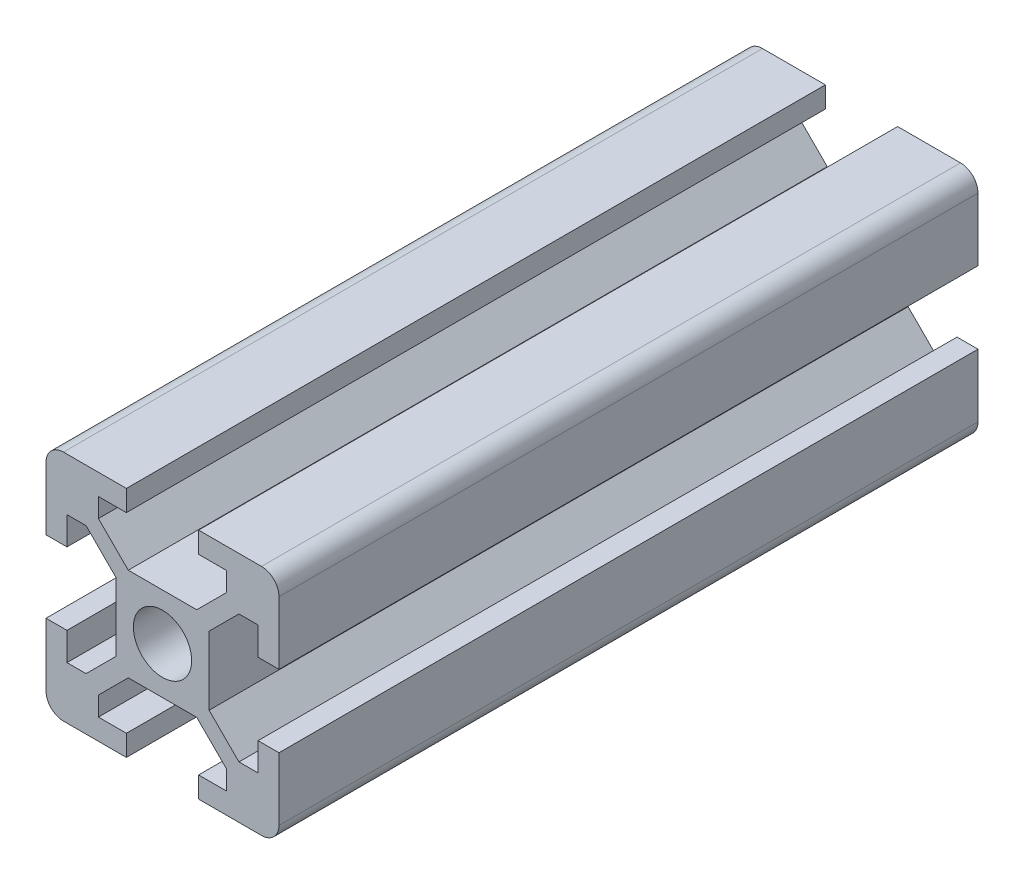
from build123d import *

# Parameters (mm, degrees)
SKETCH_1_R      = 2.5
EXTRUDE_2_DEPTH = 60


with BuildPart() as part:
    # 草图1 → 凸台-拉伸2 (new body)
    with BuildSketch(Plane.XY):
        with BuildLine():
            Line((5.5, -8.2), (5.5, -6.560660172))
            Line((5.5, -6.560660172), (2.939339828, -4))
            Line((2.939339828, -4), (-2.939339828, -4))
            Line((-2.939339828, -4), (-5.5, -6.560660172))
            Line((-5.5, -6.560660172), (-5.5, -8.2))
            Line((-5.5, -8.2), (-3.1, -8.2))
            Line((-3.1, -8.2), (-3.1, -10))
            Line((-3.1, -10), (-8.5, -10))
            ThreePointArc((-8.5, -10), (-9.560660172, -9.560660172), (-10, -8.5))
            Line((-10, -8.5), (-10, -3.1))
            Line((-10, -3.1), (-8.2, -3.1))
            Line((-8.2, -3.1), (-8.2, -5.5))
            Line((-8.2, -5.5), (-6.560660172, -5.5))
            Line((-6.560660172, -5.5), (-4, -2.939339828))
            Line((-4, -2.939339828), (-4, 2.939339828))
            Line((-4, 2.939339828), (-6.560660172, 5.5))
            Line((-6.560660172, 5.5), (-8.2, 5.5))
            Line((-8.2, 5.5), (-8.2, 3.1))
            Line((-8.2, 3.1), (-10, 3.1))
            Line((-10, 3.1), (-10, 8.5))
            ThreePointArc((-10, 8.5), (-9.560660172, 9.560660172), (-8.5, 10))
            Line((-8.5, 10), (-3.1, 10))
            Line((-3.1, 10), (-3.1, 8.2))
            Line((-3.1, 8.2), (-5.5, 8.2))
            Line((-5.5, 8.2), (-5.5, 6.560660172))
            Line((-5.5, 6.560660172), (-2.939339828, 4))
            Line((-2.939339828, 4), (2.939339828, 4))
            Line((2.939339828, 4), (5.5, 6.560660172))
            Line((5.5, 6.560660172), (5.5, 8.2))
            Line((5.5, 8.2), (3.1, 8.2))
            Line((3.1, 8.2), (3.1, 10))
            Line((3.1, 10), (8.5, 10))
            ThreePointArc((8.5, 10), (9.560660172, 9.560660172), (10, 8.5))
            Line((10, 8.5), (10, 3.1))
            Line((10, 3.1), (8.2, 3.1))
            Line((8.2, 3.1), (8.2, 5.5))
            Line((8.2, 5.5), (6.560660172, 5.5))
            Line((6.560660172, 5.5), (4, 2.939339828))
            Line((4, 2.939339828), (4, -2.939339828))
            Line((4, -2.939339828), (6.560660172, -5.5))
            Line((6.560660172, -5.5), (8.2, -5.5))
            Line((8.2, -5.5), (8.2, -3.1))
            Line((8.2, -3.1), (10, -3.1))
            Line((10, -3.1), (10, -8.5))
            ThreePointArc((10, -8.5), (9.560660172, -9.560660172), (8.5, -10))
            Line((8.5, -10), (3.1, -10))
            Line((3.1, -10), (3.1, -8.2))
            Line((3.1, -8.2), (5.5, -8.2))
        make_face()
        Circle(SKETCH_1_R, mode=Mode.SUBTRACT)
    extrude(amount=-EXTRUDE_2_DEPTH)


solid = part.part
